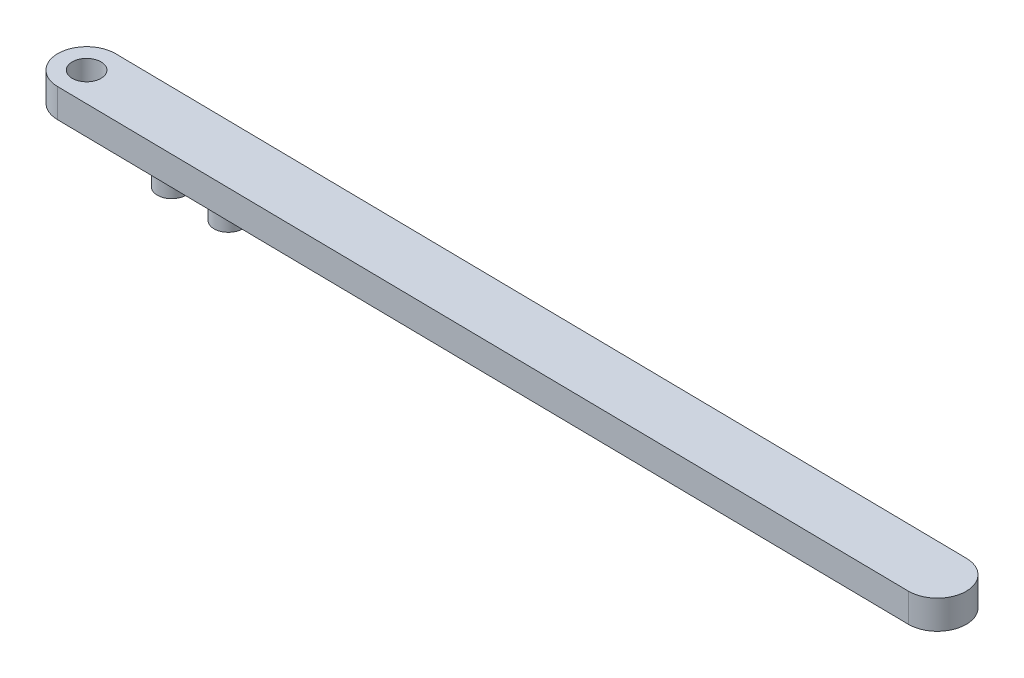
from build123d import *

# Parameters (mm, degrees)
SKETCH1_R           = 2.5
BOSS_EXTRUDE1_DEPTH = 5
SKETCH2_R           = 2.5
BOSS_EXTRUDE2_DEPTH = 10


with BuildPart() as part:
    # Sketch1 → Boss-Extrude1 (new body)
    with BuildSketch(Plane(origin=(0, 0, 0), x_dir=(1, 0, 0), z_dir=(0, 1, 0))):
        with BuildLine():
            Line((-14.504443595, 6.706697569), (135.495556405, 4.691342482))
            ThreePointArc((135.495556405, 4.691342482), (140.42793273, -0.375378724), (135.361211524, -5.30775505))
            Line((135.361211524, -5.30775505), (-14.638788476, -3.292399963))
            ThreePointArc((-14.638788476, -3.292399963), (-19.571164802, 1.774321243), (-14.504443595, 6.706697569))
        make_face()
        with Locations(Location((-14.571616036, 1.707148803, 0), (0, 0, 270))):
            Circle(SKETCH1_R, mode=Mode.SUBTRACT)
    extrude(amount=BOSS_EXTRUDE1_DEPTH)

    # Sketch2 → Boss-Extrude2 (add)
    with BuildSketch(Plane(origin=(0, 5, 0), x_dir=(1, 0, 0), z_dir=(0, 1, 0))):
        with Locations(Location((0.428383964, 1.505613294, 0), (0, 0, 270))):
            Circle(SKETCH2_R)
        with Locations(Location((10.428383964, 1.371256288, 0), (0, 0, 270))):
            Circle(SKETCH2_R)
    extrude(amount=-BOSS_EXTRUDE2_DEPTH)


solid = part.part
